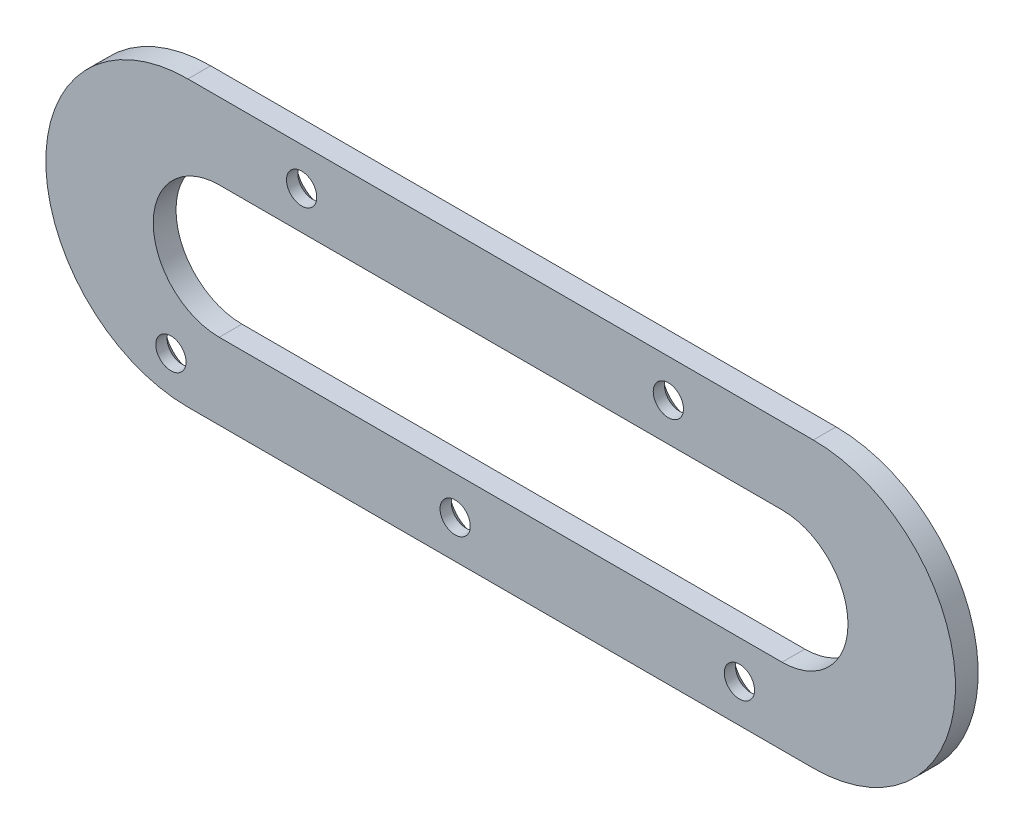
from build123d import *

# Parameters (mm, degrees)
BOSS_EXTRUDE2_DEPTH                            = 5.08
CUT_EXTRUDE1_DEPTH                             = 38.862
CSK_FOR_1_4_FLAT_HEAD_MACHINE_SCREW_2_COUNT    = 2
CSK_FOR_1_4_FLAT_HEAD_MACHINE_SCREW_2_PITCH    = 81.915
CSK_FOR_1_4_FLAT_HEAD_MACHINE_SCREW_3_AT_COUNT = 2
CSK_FOR_1_4_FLAT_HEAD_MACHINE_SCREW_3_AT_PITCH = 63.5


with BuildPart() as part:
    # Sketch1 → Boss-Extrude2 (new body)
    with BuildSketch(Plane.XY):
        with BuildLine():
            Line((-95.25, -48.631740263), (-234.95, -48.631740263))
            ThreePointArc((-234.95, -48.631740263), (-266.7, -16.881740263), (-234.95, 14.868259737))
            Line((-234.95, 14.868259737), (-95.25, 14.868259737))
            ThreePointArc((-95.25, 14.868259737), (-63.5, -16.881740263), (-95.25, -48.631740263))
        make_face()
    extrude(amount=BOSS_EXTRUDE2_DEPTH)

    # Sketch2 → Cut-Extrude1 (cut)
    with BuildSketch(Plane(origin=(0, 0, 0), x_dir=(-1, 0, 0), z_dir=(0, 0, -1))):
        with BuildLine():
            Line((227.965, -31.613740263), (102.235, -31.613740263))
            ThreePointArc((102.235, -31.613740263), (87.503, -16.881740263), (102.235, -2.149740263))
            Line((102.235, -2.149740263), (227.965, -2.149740263))
            ThreePointArc((227.965, -2.149740263), (242.697, -16.881740263), (227.965, -31.613740263))
        make_face()
    extrude(amount=-CUT_EXTRUDE1_DEPTH, mode=Mode.SUBTRACT)

    # Sketch8 → CSK for 1_4 Flat Head Machine Screw _100 (revolve, cut)
    with BuildSketch(Plane(origin=(-127.635, 6.359259737, 0), x_dir=(0, 1, 0), z_dir=(1, 0, 0))):
        Polygon((0, 0), (0, 5.08), (3.3782, 5.08), (3.3782, 2.568232241), (6.4389, 0), align=None)
    csk_for_1_4_flat_head_machine_screw_100 = revolve(axis=Axis((-127.635, 6.359259737, -6.35), (0, 0, 1)), mode=Mode.SUBTRACT)

    # CSK for 1_4 Flat Head Machine Screw  2: CSK for 1_4 Flat Head Machine Screw _100 ×2
    with Locations(*[(-i * CSK_FOR_1_4_FLAT_HEAD_MACHINE_SCREW_2_PITCH, 0, 0) for i in range(1, CSK_FOR_1_4_FLAT_HEAD_MACHINE_SCREW_2_COUNT)]):
        add(csk_for_1_4_flat_head_machine_screw_100, mode=Mode.SUBTRACT)

    # Sketch9 → CSK for 1_4 Flat Head Machine Screw  3 (revolve, cut)
    with BuildSketch(Plane(origin=(-111.76, -40.122740263, 0), x_dir=(0, 1, 0), z_dir=(1, 0, 0))):
        Polygon((0, 0), (0, 5.08), (3.3782, 5.08), (3.3782, 2.568232241), (6.4389, 0), align=None)
    csk_for_1_4_flat_head_machine_screw_3 = revolve(axis=Axis((-111.76, -40.122740263, -6.35), (0, 0, 1)), mode=Mode.SUBTRACT)

    # CSK for 1_4 Flat Head Machine Screw 3 at: CSK for 1_4 Flat Head Machine Screw  3 ×2
    with Locations(*[(-i * CSK_FOR_1_4_FLAT_HEAD_MACHINE_SCREW_3_AT_PITCH, 0, 0) for i in range(1, CSK_FOR_1_4_FLAT_HEAD_MACHINE_SCREW_3_AT_COUNT)]):
        add(csk_for_1_4_flat_head_machine_screw_3, mode=Mode.SUBTRACT)

    # Sketch10 → CSK for 1_4 Flat Head Machine Screw  4 (revolve, cut)
    with BuildSketch(Plane(origin=(-238.76, -40.122740263, 0), x_dir=(0, 1, 0), z_dir=(1, 0, 0))):
        Polygon((0, 0), (0, 5.08), (3.3782, 5.08), (3.3782, 2.568232241), (6.4389, 0), align=None)
    revolve(axis=Axis((-238.76, -40.122740263, -6.35), (0, 0, 1)), mode=Mode.SUBTRACT)


solid = part.part
